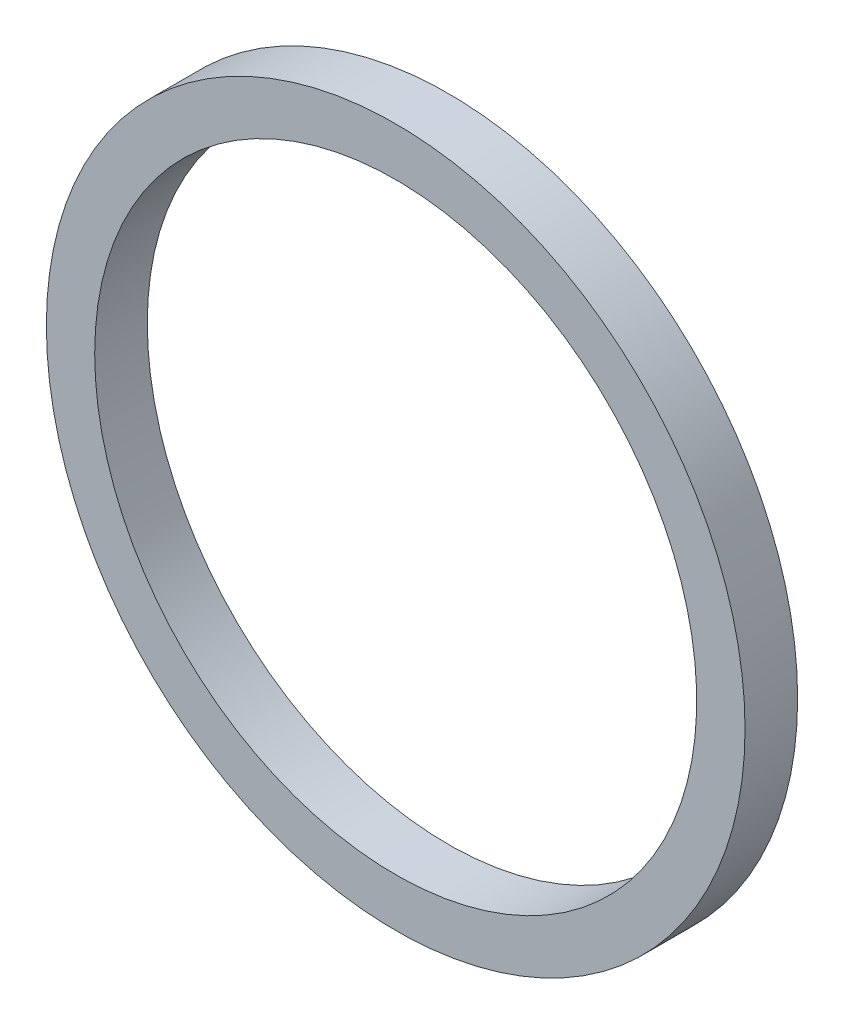
from build123d import *

# Parameters (mm, degrees)
SKETCH1_R           = 22.05
SKETCH1_R_2         = 19
BOSS_EXTRUDE1_DEPTH = 3.32


with BuildPart() as part:
    # Sketch1 → Boss-Extrude1 (new body)
    with BuildSketch(Plane.XY):
        with Locations(Location((0, 0, 0), (0, 0, 180))):
            Circle(SKETCH1_R)
        with Locations(Location((0, 0, 0), (0, 0, 180))):
            Circle(SKETCH1_R_2, mode=Mode.SUBTRACT)
    extrude(amount=BOSS_EXTRUDE1_DEPTH)


solid = part.part
